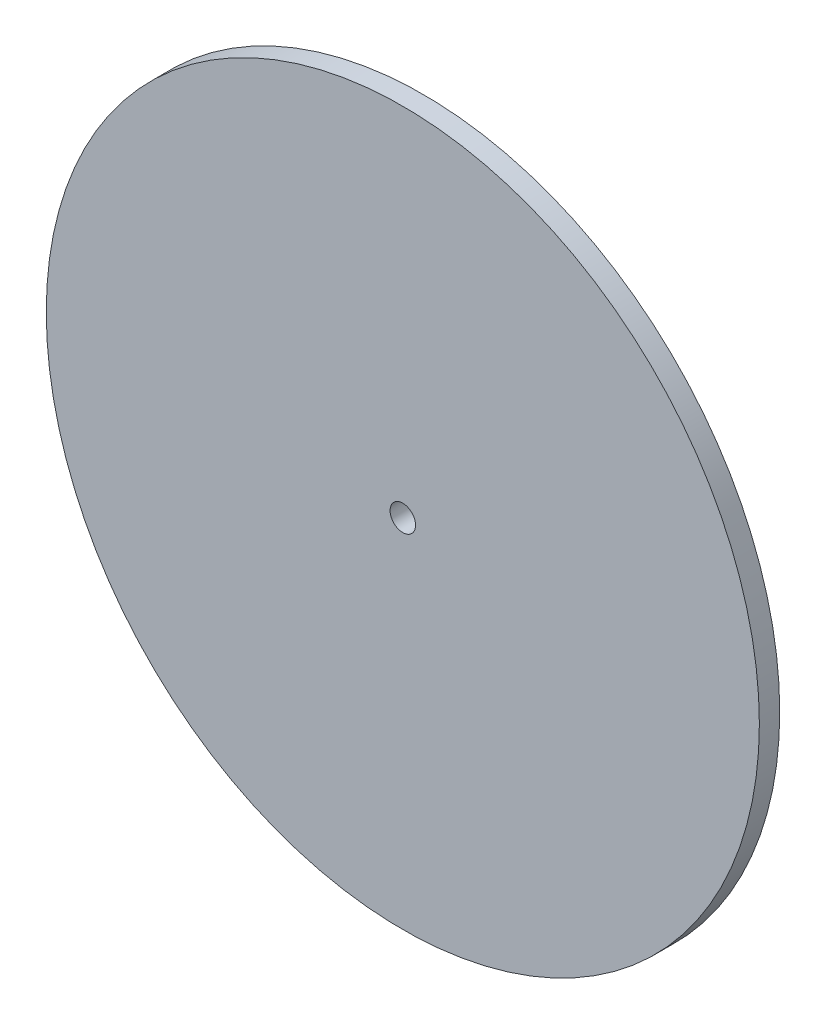
from build123d import *

# Parameters (mm, degrees)
ESQUISSE1_R             = 70
BOSS_EXTRU_1_DEPTH      = 4
ESQUISSE2_R             = 2.5
ENL_V_MAT_EXTRU_1_DEPTH = 100.075728612


with BuildPart() as part:
    # Esquisse1 → Boss.-Extru.1 (new body)
    with BuildSketch(Plane.XY):
        Circle(ESQUISSE1_R)
    extrude(amount=BOSS_EXTRU_1_DEPTH)

    # Esquisse2 → Enlèv. mat.-Extru.1 (cut, through all)
    with BuildSketch(Plane(origin=(0, 0, 0), x_dir=(-1, 0, 0), z_dir=(0, 0, -1))):
        Circle(ESQUISSE2_R)
    extrude(amount=-ENL_V_MAT_EXTRU_1_DEPTH, mode=Mode.SUBTRACT)


solid = part.part
